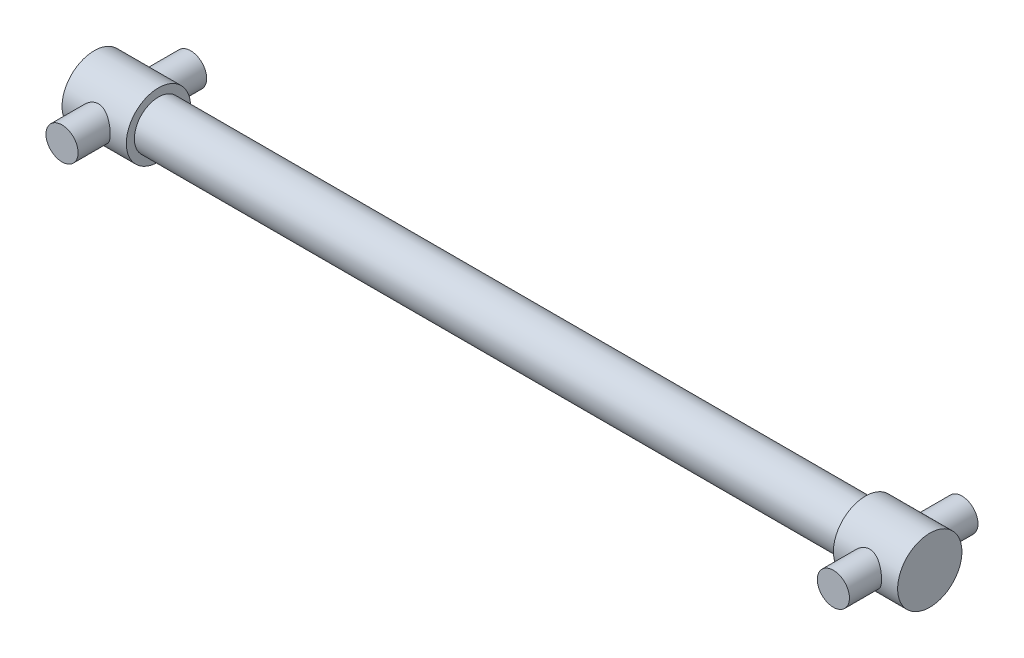
from build123d import *

# Parameters (mm, degrees)
SKETCH1_R                = 1.5
BOSS_EXTRUDE1_DEPTH      = 52
SKETCH2_R                = 2
BOSS_EXTRUDE2_DEPTH      = 4
BOSS_EXTRUDE3_START      = -4
SKETCH3_R                = 2
BOSS_EXTRUDE3_DEPTH      = 4
BOSS_EXTRUDE4_DEPTH      = 2
BOSS_EXTRUDE4_DEPTH_BACK = 6
SKETCH4_R                = 1


with BuildPart() as part:
    # Sketch1 → Boss-Extrude1 (new body)
    with BuildSketch(Plane(origin=(0, 0, 0), x_dir=(0, 0, -1), z_dir=(1, 0, 0))):
        with Locations(Location((0, 0, 0), (0, 0, 180))):
            Circle(SKETCH1_R)
    extrude(amount=BOSS_EXTRUDE1_DEPTH)

    # Sketch2 → Boss-Extrude2 (add)
    with BuildSketch(Plane(origin=(52, 0, 0), x_dir=(0, 0, -1), z_dir=(1, 0, 0))):
        Circle(SKETCH2_R)
    extrude(amount=-BOSS_EXTRUDE2_DEPTH)

    # Sketch3 → Boss-Extrude3 (add)
    with BuildSketch(Plane.ZY.offset(BOSS_EXTRUDE3_START)):
        with Locations(Location((0, 0, 0), (0, 0, 180))):
            Circle(SKETCH3_R)
    extrude(amount=BOSS_EXTRUDE3_DEPTH)

    # Sketch4 → Boss-Extrude4 (add, two sides: drawn at the far end of the back side and taken through both)
    with BuildSketch(Plane.XY.offset(2).offset(-BOSS_EXTRUDE4_DEPTH_BACK)):
        with Locations((50, 0)):
            Circle(SKETCH4_R)
        with Locations((2, 0)):
            Circle(SKETCH4_R)
    extrude(amount=BOSS_EXTRUDE4_DEPTH + BOSS_EXTRUDE4_DEPTH_BACK)


solid = part.part
